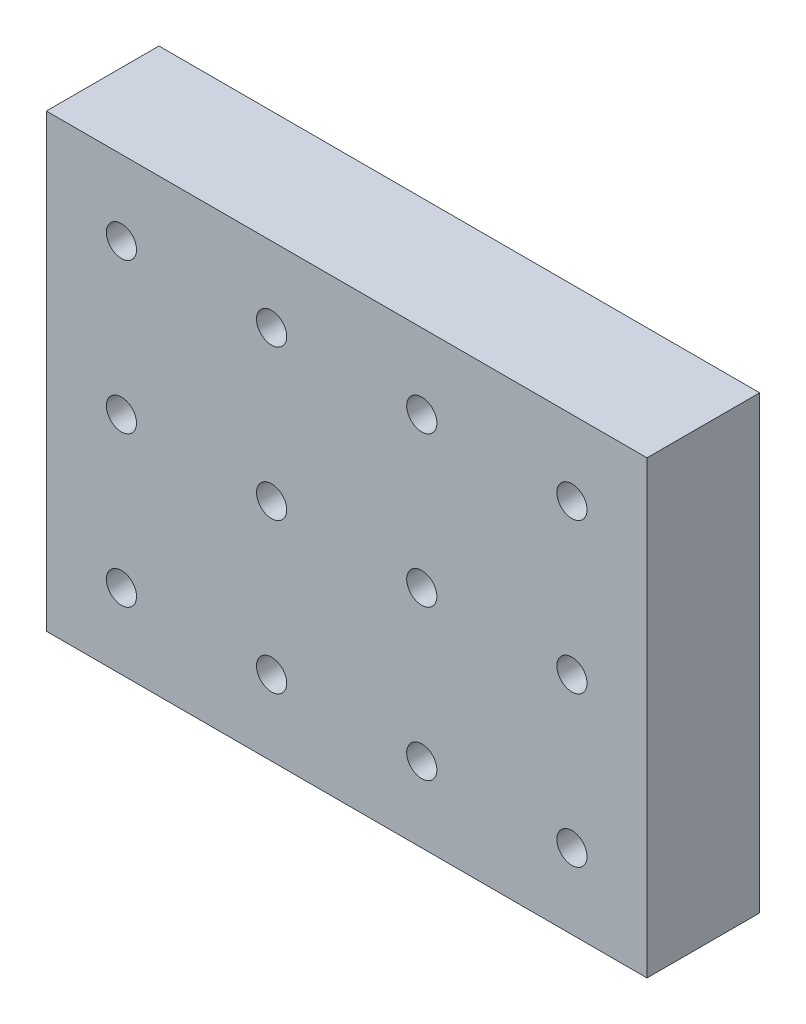
from build123d import *

# Parameters (mm, degrees)
SKETCH1_W               = 101.6
SKETCH1_H               = 76.2
BOSS_EXTRUDE1_DEPTH     = 19.05
F_1_4_20_TAPPED_HOLE1_D = 5.1054
LPATTERN1_COUNT         = 4
LPATTERN1_PITCH         = 25.4
LPATTERN1_COUNT_DIR2    = 3
LPATTERN1_PITCH_DIR2    = 25.4


with BuildPart() as part:
    # Sketch1 → Boss-Extrude1 (new body)
    with BuildSketch(Plane.XY):
        with Locations((50.8, 38.1)):
            Rectangle(SKETCH1_W, SKETCH1_H)
    extrude(amount=BOSS_EXTRUDE1_DEPTH)

    # 1/4-20 Tapped Hole1 (through all)
    with Locations(Plane.XY.offset(19.05)):
        with Locations((12.7, 63.5)):
            f_1_4_20_tapped_hole1 = Hole(F_1_4_20_TAPPED_HOLE1_D / 2)

    # LPattern1: 1_4-20 Tapped Hole1 4 × 3
    with Locations(*[(i * LPATTERN1_PITCH, -j * LPATTERN1_PITCH_DIR2, 0) for i in range(LPATTERN1_COUNT) for j in range(LPATTERN1_COUNT_DIR2) if (i, j) != (0, 0)]):
        add(f_1_4_20_tapped_hole1, mode=Mode.SUBTRACT)


solid = part.part
